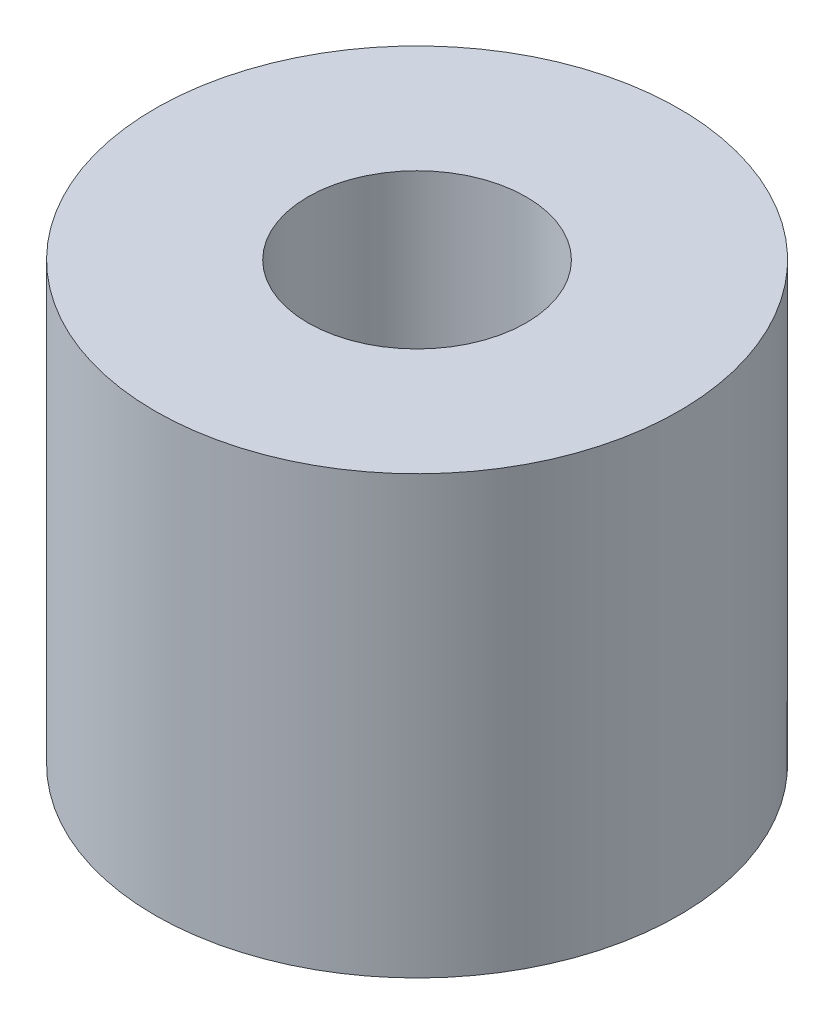
from build123d import *

# Parameters (mm, degrees)
SKETCH_1_R      = 3
SKETCH_1_R_2    = 1.25
EXTRUDE_1_DEPTH = 5


with BuildPart() as part:
    # Эскиз1 → Бобышка-Вытянуть1 (new body)
    with BuildSketch(Plane(origin=(0, 0, 0), x_dir=(1, 0, 0), z_dir=(0, 1, 0))):
        with Locations(Location((0, 0, 0), (0, 0, 270))):
            Circle(SKETCH_1_R)
        with Locations(Location((0, 0, 0), (0, 0, 270))):
            Circle(SKETCH_1_R_2, mode=Mode.SUBTRACT)
    extrude(amount=EXTRUDE_1_DEPTH)


solid = part.part
